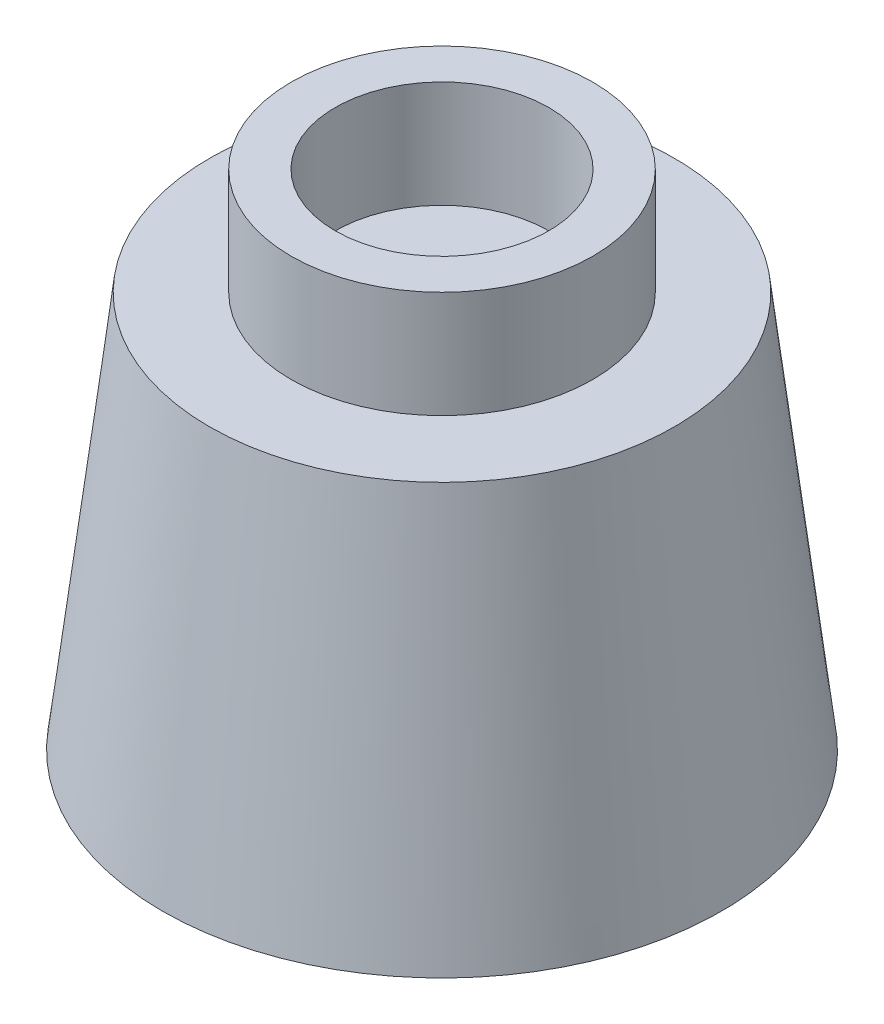
from build123d import *

# Parameters (mm, degrees)
SKETCH1_R           = 4.45
SKETCH2_R           = 3.7
SKETCH3_R           = 2.4
SKETCH3_R_2         = 1.7
BOSS_EXTRUDE1_DEPTH = 1.7
SKETCH4_R           = 3.450229513
CUT_EXTRUDE1_DEPTH  = 2.4
SKETCH5_R           = 2.450229513
CUT_EXTRUDE2_DEPTH  = 3.1


with BuildPart() as part:
    # Sketch1 → Loft1 section 0
    with BuildSketch(Plane(origin=(0, 0, 0), x_dir=(1, 0, 0), z_dir=(0, 1, 0))):
        Circle(SKETCH1_R)
    # Sketch2 → Loft1 section 1
    with BuildSketch(Plane(origin=(0, 6.3, 0), x_dir=(1, 0, 0), z_dir=(0, 1, 0))):
        Circle(SKETCH2_R)
    loft()

    # Sketch3 → Boss-Extrude1 (add)
    with BuildSketch(Plane(origin=(0, 6.3, 0), x_dir=(1, 0, 0), z_dir=(0, 1, 0))):
        with Locations(Location((0, 0, 0), (0, 0, 270))):
            Circle(SKETCH3_R)
        with Locations(Location((0, 0, 0), (0, 0, 270))):
            Circle(SKETCH3_R_2, mode=Mode.SUBTRACT)
    extrude(amount=BOSS_EXTRUDE1_DEPTH)

    # Sketch4 → Cut-Extrude1 (cut)
    with BuildSketch(Plane.XZ):
        with Locations(Location((0, 0, 0), (0, 0, 270))):
            Circle(SKETCH4_R)
    extrude(amount=-CUT_EXTRUDE1_DEPTH, mode=Mode.SUBTRACT)

    # Sketch5 → Cut-Extrude2 (cut)
    with BuildSketch(Plane.XZ.offset(-2.4)):
        with Locations(Location((0, 0, 0), (0, 0, 270))):
            Circle(SKETCH5_R)
    extrude(amount=-CUT_EXTRUDE2_DEPTH, mode=Mode.SUBTRACT)


solid = part.part
